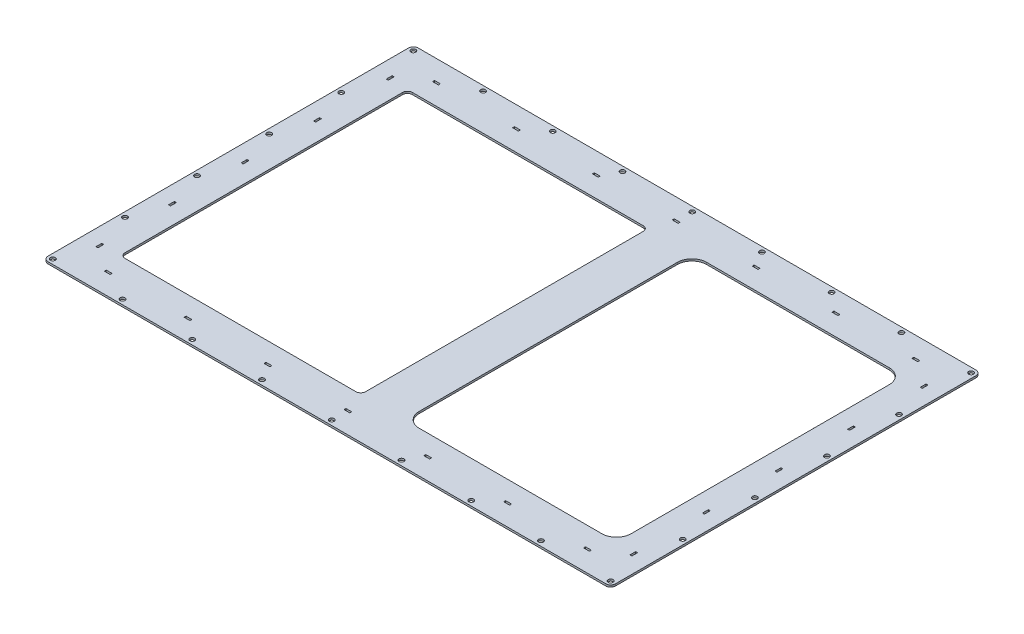
from build123d import *

# Parameters (mm, degrees)
SKETCH_1_W                  = 1165
SKETCH_1_H                  = 760
SKETCH_1_W_2                = 494
SKETCH_1_H_2                = 590
SKETCH_1_W_3                = 435
EXTRUDE_1_DEPTH             = 2
FILLET_1_R                  = 10
FILLET_2_R                  = 30
SKETCH_2_R                  = 5
CUT_EXTRUDE_1_DEPTH         = 696.501437813
PATTERN_LINEAR_1_COUNT      = 6
PATTERN_LINEAR_1_PITCH      = 148
PATTERN_LINEAR_1_COUNT_DIR2 = 9
PATTERN_LINEAR_1_PITCH_DIR2 = 143.125
SKETCH_3_W                  = 12
SKETCH_3_H                  = 4
SKETCH_3_W_2                = 4
SKETCH_3_H_2                = 12
CUT_EXTRUDE_2_DEPTH         = 696.501437813


with BuildPart() as part:
    # Эскиз1 → Бобышка-Вытянуть1 (new, symmetric)
    with BuildSketch(Plane(origin=(0, 0, 0), x_dir=(1, 0, 0), z_dir=(0, 1, 0))):
        Rectangle(SKETCH_1_W, SKETCH_1_H)
        with Locations((-262.5, 0)):
            Rectangle(SKETCH_1_W_2, SKETCH_1_H_2, mode=Mode.SUBTRACT)
        with Locations((292, 0)):
            Rectangle(SKETCH_1_W_3, SKETCH_1_H_2, mode=Mode.SUBTRACT)
    extrude(amount=EXTRUDE_1_DEPTH, both=True)

    # Скругление1
    fillet_1_edges = [part.edges().sort_by_distance(p)[0] for p in [
        (-509.5, 0, -295),
        (-509.5, 0, 295),
        (-15.5, 0, 295),
        (-15.5, 0, -295),
        (582.5, 0, 380),
        (-582.5, 0, 380),
        (-582.5, 0, -380),
        (582.5, 0, -380),
    ]]
    fillet(fillet_1_edges, radius=FILLET_1_R)

    # Скругление2
    fillet_2_edges = [part.edges().sort_by_distance(p)[0] for p in [
        (74.5, 0, -295),
        (74.5, 0, 295),
        (509.5, 0, 295),
        (509.5, 0, -295),
    ]]
    fillet(fillet_2_edges, radius=FILLET_2_R)

    # Эскиз2 → Вырез-Вытянуть1 (cut, through all)
    with BuildSketch(Plane(origin=(0, 2, 0), x_dir=(1, 0, 0), z_dir=(0, 1, 0))):
        with Locations(Location((-572.5, -370, 0), (0, 0, 270))):
            Circle(SKETCH_2_R)
    cut_extrude_1 = extrude(amount=-CUT_EXTRUDE_1_DEPTH, mode=Mode.SUBTRACT)

    # Линейный массив1: Cut-Extrude 1 6 × 9, 25 skipped
    with Locations(*[(j * PATTERN_LINEAR_1_PITCH_DIR2, 0, -i * PATTERN_LINEAR_1_PITCH) for i in range(PATTERN_LINEAR_1_COUNT) for j in range(PATTERN_LINEAR_1_COUNT_DIR2) if (i, j) not in ((0, 0), (1, 1), (1, 2), (1, 3), (1, 4), (1, 5), (1, 6), (1, 7), (2, 1), (2, 2), (2, 3), (2, 4), (2, 5), (2, 6), (2, 7), (3, 1), (3, 2), (3, 3), (3, 4), (3, 5), (3, 6), (3, 7), (4, 1), (4, 2), (4, 3), (4, 4))]):
        add(cut_extrude_1, mode=Mode.SUBTRACT)

    # Эскиз3 → Вырез-Вытянуть2 (cut, through all)
    with BuildSketch(Plane(origin=(0, 2, 0), x_dir=(1, 0, 0), z_dir=(0, 1, 0))):
        with Locations((492, 337)):
            Rectangle(SKETCH_3_W, SKETCH_3_H)
        with Locations((328, 337)):
            Rectangle(SKETCH_3_W, SKETCH_3_H)
        with Locations((0, 337)):
            Rectangle(SKETCH_3_W, SKETCH_3_H)
        with Locations((164, 337)):
            Rectangle(SKETCH_3_W, SKETCH_3_H)
        with Locations((-492, 337)):
            Rectangle(SKETCH_3_W, SKETCH_3_H)
        with Locations((-164, 337)):
            Rectangle(SKETCH_3_W, SKETCH_3_H)
        with Locations((-328, 337)):
            Rectangle(SKETCH_3_W, SKETCH_3_H)
        with Locations((492, -337)):
            Rectangle(SKETCH_3_W, SKETCH_3_H)
        with Locations((328, -337)):
            Rectangle(SKETCH_3_W, SKETCH_3_H)
        with Locations((0, -337)):
            Rectangle(SKETCH_3_W, SKETCH_3_H)
        with Locations((164, -337)):
            Rectangle(SKETCH_3_W, SKETCH_3_H)
        with Locations((-492, -337)):
            Rectangle(SKETCH_3_W, SKETCH_3_H)
        with Locations((-164, -337)):
            Rectangle(SKETCH_3_W, SKETCH_3_H)
        with Locations((-328, -337)):
            Rectangle(SKETCH_3_W, SKETCH_3_H)
        with Locations((-548, 149)):
            Rectangle(SKETCH_3_W_2, SKETCH_3_H_2)
        with Locations((-548, 298)):
            Rectangle(SKETCH_3_W_2, SKETCH_3_H_2)
        with Locations((-548, -149)):
            Rectangle(SKETCH_3_W_2, SKETCH_3_H_2)
        with Locations((-548, 0)):
            Rectangle(SKETCH_3_W_2, SKETCH_3_H_2)
        with Locations((-548, -298)):
            Rectangle(SKETCH_3_W_2, SKETCH_3_H_2)
        with Locations((548, -149)):
            Rectangle(SKETCH_3_W_2, SKETCH_3_H_2)
        with Locations((548, -298)):
            Rectangle(SKETCH_3_W_2, SKETCH_3_H_2)
        with Locations((548, 149)):
            Rectangle(SKETCH_3_W_2, SKETCH_3_H_2)
        with Locations((548, 0)):
            Rectangle(SKETCH_3_W_2, SKETCH_3_H_2)
        with Locations((548, 298)):
            Rectangle(SKETCH_3_W_2, SKETCH_3_H_2)
    extrude(amount=-CUT_EXTRUDE_2_DEPTH, mode=Mode.SUBTRACT)


solid = part.part
